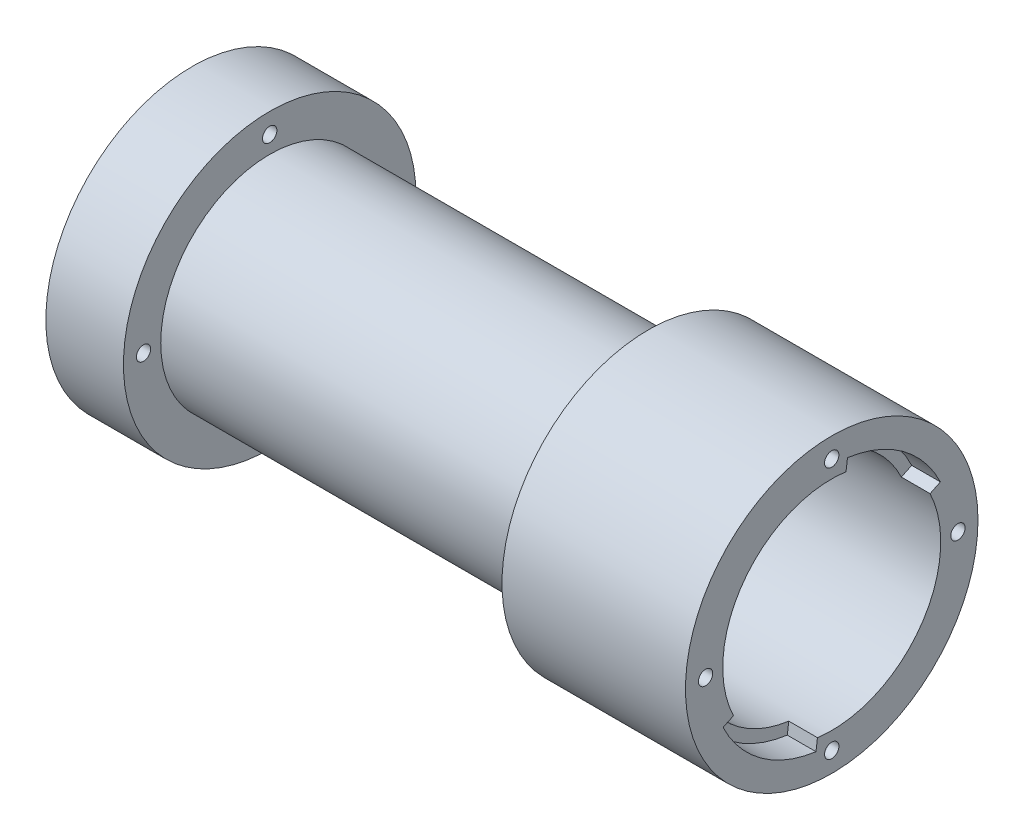
from build123d import *

# Parameters (mm, degrees)
EXTRUDE_1_DEPTH      = 18
EXTRUDE_1_DEPTH_BACK = 9.06
SKETCH_1_R           = 51
SKETCH_1_R_2         = 31
SKETCH_2_R           = 38
SKETCH_2_R_2         = 27
EXTRUDE_2_DEPTH      = 132
SKETCH_3_R           = 51
SKETCH_3_R_2         = 38
EXTRUDE_3_DEPTH      = 63.98
CUT_EXTRUDE_START    = -223.04
SKETCH_4_R           = 2.5
CUT_EXTRUDE_1_DEPTH  = 223.04
CUT_EXTRUDE_START_2  = -10
CUT_EXTRUDE_2_DEPTH  = 10
SKETCH_6_R           = 31
CUT_EXTRUDE_3_DEPTH  = 14


with BuildPart() as part:
    # 草图1 → 凸台-拉伸1 (new, two sides: drawn at the far end of the back side and taken through both)
    with BuildSketch(Plane(origin=(0, 0, 0), x_dir=(0, 0, -1), z_dir=(1, 0, 0)).offset(-EXTRUDE_1_DEPTH_BACK)):
        Circle(SKETCH_1_R)
        Circle(SKETCH_1_R_2, mode=Mode.SUBTRACT)
    extrude(amount=EXTRUDE_1_DEPTH + EXTRUDE_1_DEPTH_BACK)

    # 草图2 → 凸台-拉伸2 (add)
    with BuildSketch(Plane(origin=(18, 0, 0), x_dir=(0, 0, -1), z_dir=(1, 0, 0))):
        Circle(SKETCH_2_R)
        Circle(SKETCH_2_R_2, mode=Mode.SUBTRACT)
    extrude(amount=EXTRUDE_2_DEPTH)


with BuildPart() as body_2:
    # 草图3 → 凸台-拉伸3 (new body)
    with BuildSketch(Plane(origin=(150, 0, 0), x_dir=(0, 0, -1), z_dir=(1, 0, 0))):
        Circle(SKETCH_3_R)
        Circle(SKETCH_3_R_2, mode=Mode.SUBTRACT)
    extrude(amount=EXTRUDE_3_DEPTH)


with BuildPart() as cut_extrude_1_tool:
    # 草图4 → 切除-拉伸1 (new body)
    with BuildSketch(Plane.ZY.offset(9.06).offset(CUT_EXTRUDE_START)):
        with Locations(Location((0, 44, 0), (0, 0, 180))):
            Circle(SKETCH_4_R)
        with Locations(Location((44, 0, 0), (0, 0, 180))):
            Circle(SKETCH_4_R)
        with Locations(Location((0, -44, 0), (0, 0, 180))):
            Circle(SKETCH_4_R)
        with Locations(Location((-44, 0, 0), (0, 0, 180))):
            Circle(SKETCH_4_R)
    extrude(amount=CUT_EXTRUDE_1_DEPTH)


with BuildPart() as part_1:
    add(part.part)

    # 切除-拉伸1: cut by cut_extrude_1_tool
    add(cut_extrude_1_tool.part, mode=Mode.SUBTRACT)

    # 草图6 → 切除-拉伸3 (cut)
    with BuildSketch(Plane(origin=(150, 0, 0), x_dir=(0, 0, -1), z_dir=(1, 0, 0))):
        Circle(SKETCH_6_R)
    extrude(amount=-CUT_EXTRUDE_3_DEPTH, mode=Mode.SUBTRACT)


with BuildPart() as body_2_1:
    add(body_2.part)

    # 切除-拉伸1: cut by cut_extrude_1_tool
    add(cut_extrude_1_tool.part, mode=Mode.SUBTRACT)

    # 草图5 → 切除-拉伸2 (cut)
    with BuildSketch(Plane(origin=(213.98, 0, 0), x_dir=(0, 0, -1), z_dir=(1, 0, 0)).offset(CUT_EXTRUDE_START_2)):
        with BuildLine():
            Line((4.979052634, 37.672390883), (5.503163437, 41.637905713))
            ThreePointArc((5.503163437, 41.637905713), (12.280668917, 40.16447648), (18.723271545, 37.595732506))
            ThreePointArc((18.723271545, 37.595732506), (26.533013809, 32.557628572), (33.043562457, 25.925334717))
            ThreePointArc((33.043562457, 25.925334717), (35.678505016, 22.159518943), (37.886189575, 18.128338023))
            Line((37.886189575, 18.128338023), (34.277981044, 16.40182964))
            ThreePointArc((34.277981044, 16.40182964), (32.280552158, 20.049088568), (29.896556508, 23.45625522))
            ThreePointArc((29.896556508, 23.45625522), (24.006060113, 29.456902041), (16.940102827, 34.015186553))
            ThreePointArc((16.940102827, 34.015186553), (11.111081401, 36.339288244), (4.979052634, 37.672390883))
        make_face()
        with BuildLine():
            Line((-4.979052634, -37.672390883), (-5.503163437, -41.637905713))
            ThreePointArc((-5.503163437, -41.637905713), (-12.280668917, -40.16447648), (-18.723271545, -37.595732506))
            ThreePointArc((-18.723271545, -37.595732506), (-26.533013809, -32.557628572), (-33.043562457, -25.925334717))
            ThreePointArc((-33.043562457, -25.925334717), (-35.678505016, -22.159518943), (-37.886189575, -18.128338023))
            Line((-37.886189575, -18.128338023), (-34.277981044, -16.40182964))
            ThreePointArc((-34.277981044, -16.40182964), (-32.280552158, -20.049088568), (-29.896556508, -23.45625522))
            ThreePointArc((-29.896556508, -23.45625522), (-24.006060113, -29.456902041), (-16.940102827, -34.015186553))
            ThreePointArc((-16.940102827, -34.015186553), (-11.111081401, -36.339288244), (-4.979052634, -37.672390883))
        make_face()
    extrude(amount=CUT_EXTRUDE_2_DEPTH, mode=Mode.SUBTRACT)


solid = Compound([part_1.part, body_2_1.part])
